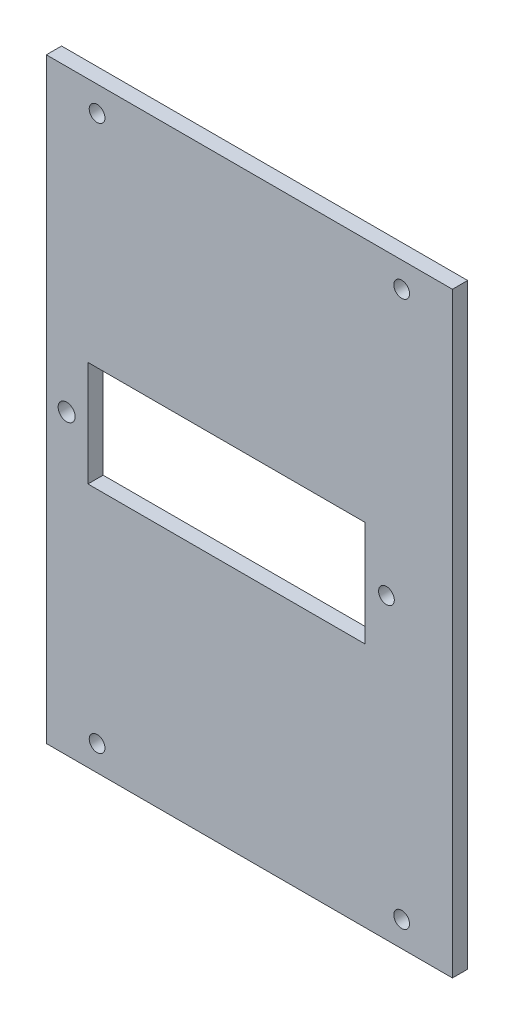
from build123d import *

# Parameters (mm, degrees)
SKETCH_1_W          = 80
SKETCH_1_H          = 117.5
SKETCH_1_W_2        = 35
SKETCH_1_H_2        = 15
EXTRUDE_1_DEPTH     = 3
CUT_EXTRUDE_2_REACH = 144.18
SKETCH_3_R          = 1.55
CUT_EXTRUDE_3_REACH = 144.18
SKETCH_4_R          = 1.55
SKETCH_5_R          = 1.67340685
CUT_EXTRUDE_4_DEPTH = 10
SKETCH_6_W          = 45.612722832
SKETCH_6_H          = 20.743194246
CUT_EXTRUDE_5_DEPTH = 10
SKETCH_7_W          = 3
SKETCH_7_H          = 20.743194246
CUT_EXTRUDE_6_DEPTH = 9


with BuildPart() as part:
    # 草图1 → 凸台-拉伸1 (new body)
    with BuildSketch(Plane.XY):
        with Locations((40, 58.75)):
            Rectangle(SKETCH_1_W, SKETCH_1_H)
        with Locations((40, 58.75)):
            Rectangle(SKETCH_1_W_2, SKETCH_1_H_2, mode=Mode.SUBTRACT)
    extrude(amount=EXTRUDE_1_DEPTH)

    # 草图3 → 切除-拉伸2 (cut, up to next)
    with BuildSketch(Plane.XY.offset(3), mode=Mode.PRIVATE) as cut_extrude_2_sk1:
        with Locations((10, 112.5)):
            Circle(SKETCH_3_R)
    cut_extrude_2_tool1 = extrude(cut_extrude_2_sk1.sketch, amount=-CUT_EXTRUDE_2_REACH, mode=Mode.PRIVATE) & part.part
    # 草图3 → 切除-拉伸2 (cut, up to next)
    with BuildSketch(Plane.XY.offset(3), mode=Mode.PRIVATE) as cut_extrude_2_sk2:
        with Locations((70, 112.5)):
            Circle(SKETCH_3_R)
    cut_extrude_2_tool2 = extrude(cut_extrude_2_sk2.sketch, amount=-CUT_EXTRUDE_2_REACH, mode=Mode.PRIVATE) & part.part
    # 草图3 → 切除-拉伸2 (cut, up to next)
    with BuildSketch(Plane.XY.offset(3), mode=Mode.PRIVATE) as cut_extrude_2_sk3:
        with Locations((70, 5)):
            Circle(SKETCH_3_R)
    cut_extrude_2_tool3 = extrude(cut_extrude_2_sk3.sketch, amount=-CUT_EXTRUDE_2_REACH, mode=Mode.PRIVATE) & part.part
    # 草图3 → 切除-拉伸2 (cut, up to next)
    with BuildSketch(Plane.XY.offset(3), mode=Mode.PRIVATE) as cut_extrude_2_sk4:
        with Locations((10, 5)):
            Circle(SKETCH_3_R)
    cut_extrude_2_tool4 = extrude(cut_extrude_2_sk4.sketch, amount=-CUT_EXTRUDE_2_REACH, mode=Mode.PRIVATE) & part.part
    add(cut_extrude_2_tool1.solids().sort_by_distance((10, 112.5, 3))[0], mode=Mode.SUBTRACT)
    add(cut_extrude_2_tool2.solids().sort_by_distance((70, 112.5, 3))[0], mode=Mode.SUBTRACT)
    add(cut_extrude_2_tool3.solids().sort_by_distance((70, 5, 3))[0], mode=Mode.SUBTRACT)
    add(cut_extrude_2_tool4.solids().sort_by_distance((10, 5, 3))[0], mode=Mode.SUBTRACT)

    # 草图4 → 切除-拉伸3 (cut, up to next)
    with BuildSketch(Plane(origin=(0, 0, 0), x_dir=(-1, 0, 0), z_dir=(0, 0, -1)), mode=Mode.PRIVATE) as cut_extrude_3_sk1:
        with Locations((-67, 58.75)):
            Circle(SKETCH_4_R)
    cut_extrude_3_tool1 = extrude(cut_extrude_3_sk1.sketch, amount=-CUT_EXTRUDE_3_REACH, mode=Mode.PRIVATE) & part.part
    # 草图4 → 切除-拉伸3 (cut, up to next)
    with BuildSketch(Plane(origin=(0, 0, 0), x_dir=(-1, 0, 0), z_dir=(0, 0, -1)), mode=Mode.PRIVATE) as cut_extrude_3_sk2:
        with Locations((-13, 58.75)):
            Circle(SKETCH_4_R)
    cut_extrude_3_tool2 = extrude(cut_extrude_3_sk2.sketch, amount=-CUT_EXTRUDE_3_REACH, mode=Mode.PRIVATE) & part.part
    add(cut_extrude_3_tool1.solids().sort_by_distance((67, 58.75, 0))[0], mode=Mode.SUBTRACT)
    add(cut_extrude_3_tool2.solids().sort_by_distance((13, 58.75, 0))[0], mode=Mode.SUBTRACT)

    # 草图5 → 切除-拉伸4 (cut)
    with BuildSketch(Plane(origin=(0, 0, 0), x_dir=(-1, 0, 0), z_dir=(0, 0, -1))):
        with Locations((-4, 58.576267849)):
            Circle(SKETCH_5_R)
    extrude(amount=-CUT_EXTRUDE_4_DEPTH, mode=Mode.SUBTRACT)

    # 草图6 → 切除-拉伸5 (cut)
    with BuildSketch(Plane.XY.offset(3)):
        with Locations((40, 58.75)):
            Rectangle(SKETCH_6_W, SKETCH_6_H)
    extrude(amount=-CUT_EXTRUDE_5_DEPTH, mode=Mode.SUBTRACT)

    # 草图7 → 切除-拉伸6 (cut)
    with BuildSketch(Plane(origin=(17.193638584, 0, 0), x_dir=(0, 0, -1), z_dir=(1, 0, 0))):
        with Locations((-1.5, 58.75)):
            Rectangle(SKETCH_7_W, SKETCH_7_H)
    extrude(amount=-CUT_EXTRUDE_6_DEPTH, mode=Mode.SUBTRACT)


solid = part.part
